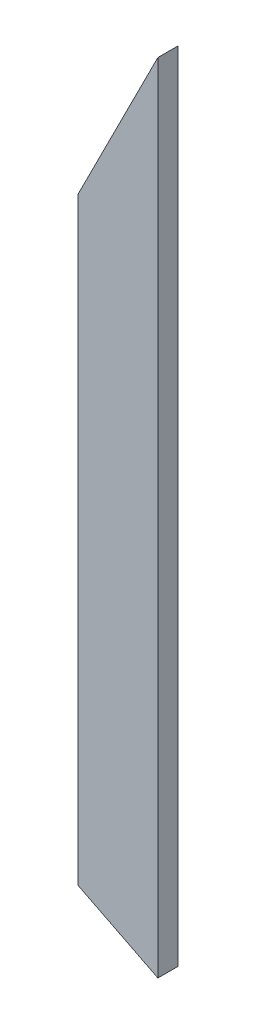
from build123d import *

# Parameters (mm, degrees)
BOSS_EXTRUDE1_DEPTH = 12.7


with BuildPart() as part:
    # Sketch1 → Boss-Extrude1 (new body)
    with BuildSketch(Plane.XY):
        Polygon((25.4, -254), (25.4, 254), (-25.4, 153.313426039), (-25.4, -228.377454927), align=None)
    extrude(amount=BOSS_EXTRUDE1_DEPTH)


solid = part.part
